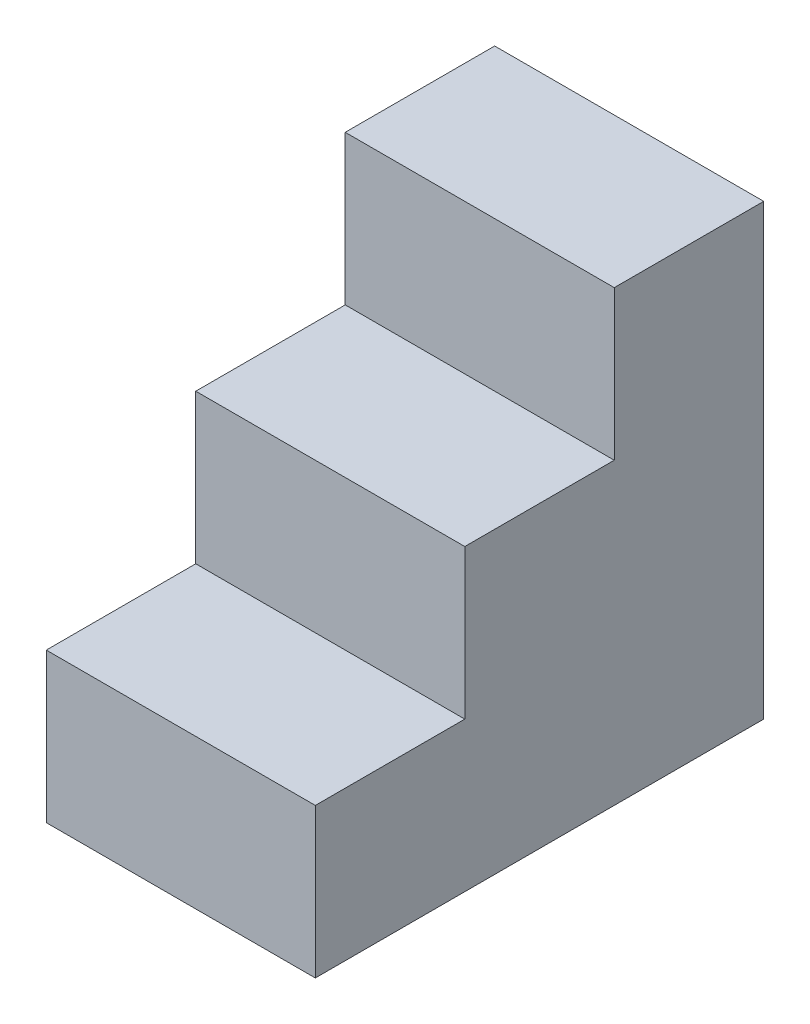
from build123d import *

# Parameters (mm, degrees)
EXTRUDE_1_DEPTH = 19.8


with BuildPart() as part:
    # 草图1 → 凸台-拉伸1 (new body)
    with BuildSketch(Plane(origin=(0, 0, 0), x_dir=(0, 0, -1), z_dir=(1, 0, 0))):
        Polygon((0, 0), (-11, 0), (-11, -11), (-22, -11), (-22, -22), (-33, -22), (-33, -33), (0, -33), align=None)
    extrude(amount=EXTRUDE_1_DEPTH)


solid = part.part
